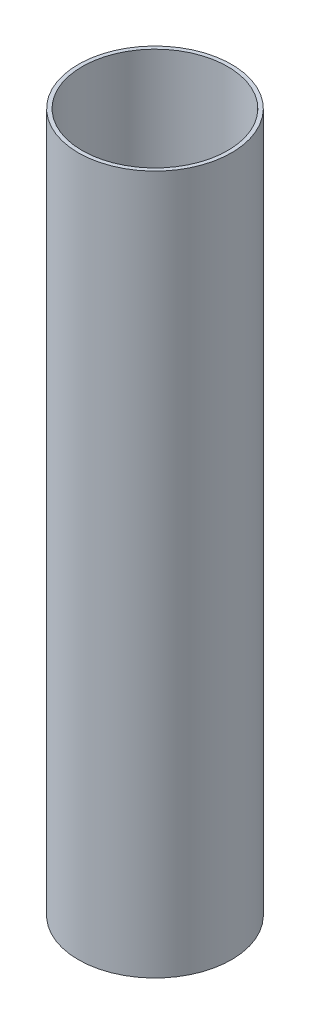
from build123d import *

# Parameters (mm, degrees)
SKETCH1_R           = 32.9
SKETCH1_R_2         = 31.25
BOSS_EXTRUDE1_DEPTH = 150


with BuildPart() as part:
    # Sketch1 → Boss-Extrude1 (new, symmetric)
    with BuildSketch(Plane(origin=(0, 0, 0), x_dir=(1, 0, 0), z_dir=(0, 1, 0))):
        with Locations(Location((0, 0, 0), (0, 0, 270))):
            Circle(SKETCH1_R)
        with Locations(Location((0, 0, 0), (0, 0, 270))):
            Circle(SKETCH1_R_2, mode=Mode.SUBTRACT)
    extrude(amount=BOSS_EXTRUDE1_DEPTH, both=True)


solid = part.part
